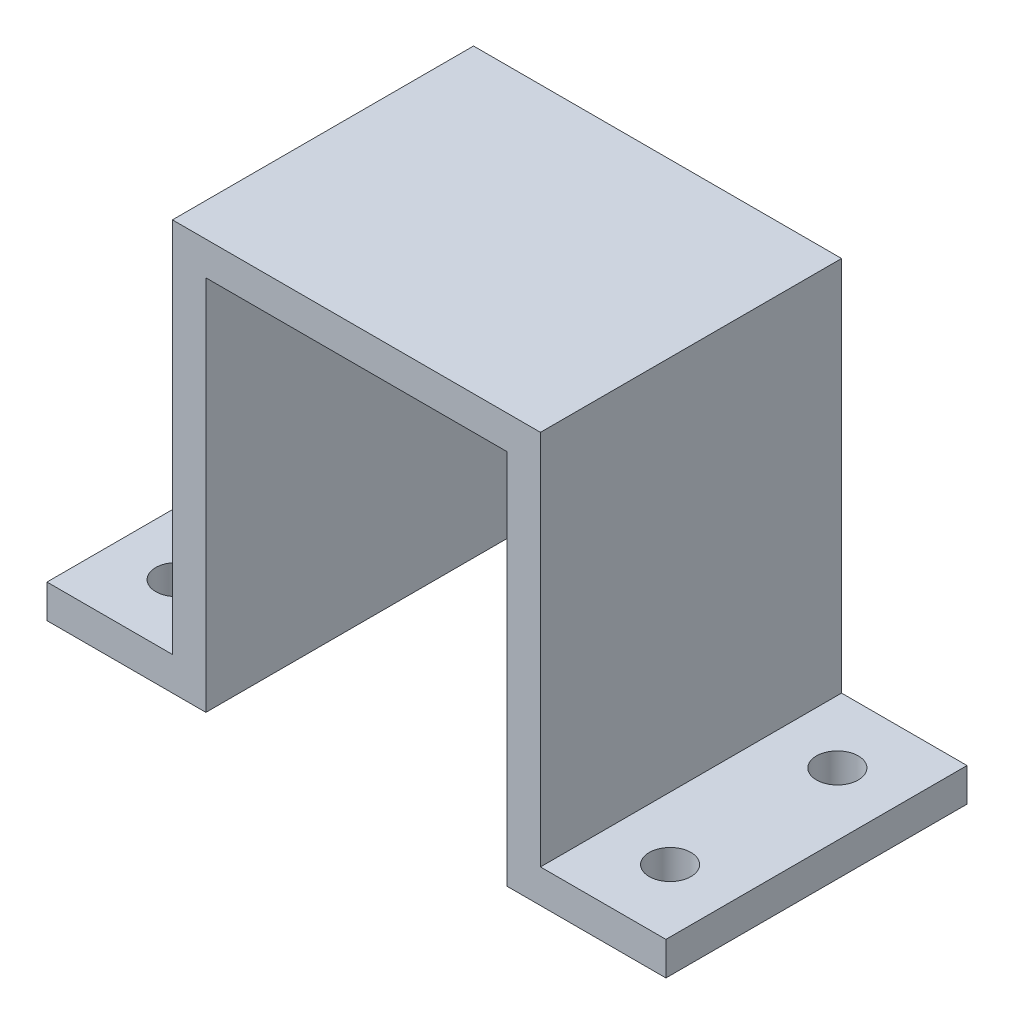
from build123d import *

# Parameters (mm, degrees)
EXTRUDE_1_DEPTH     = 36
SKETCH_2_R          = 2.5
CUT_EXTRUDE_1_DEPTH = 36


with BuildPart() as part:
    # 草图1 → 凸台-拉伸1 (new body)
    with BuildSketch(Plane.XY):
        Polygon((-4, 0), (0, 0), (36, 0), (40, 0), (40, -45), (55, -45), (55, -49), (40, -49), (36, -49), (36, -4), (0, -4), (0, -49), (-4, -49), (-19, -49), (-19, -45), (-4, -45), align=None)
    extrude(amount=EXTRUDE_1_DEPTH)

    # 草图2 → 切除-拉伸1 (cut)
    with BuildSketch(Plane(origin=(0, -45, 0), x_dir=(1, 0, 0), z_dir=(0, 1, 0))):
        with Locations(Location((-11.5, -8, 0), (0, 0, 270))):
            Circle(SKETCH_2_R)
        with Locations(Location((-11.5, -28, 0), (0, 0, 270))):
            Circle(SKETCH_2_R)
        with Locations(Location((47.5, -28, 0), (0, 0, 270))):
            Circle(SKETCH_2_R)
        with Locations(Location((47.5, -8, 0), (0, 0, 270))):
            Circle(SKETCH_2_R)
    extrude(amount=-CUT_EXTRUDE_1_DEPTH, mode=Mode.SUBTRACT)


solid = part.part
